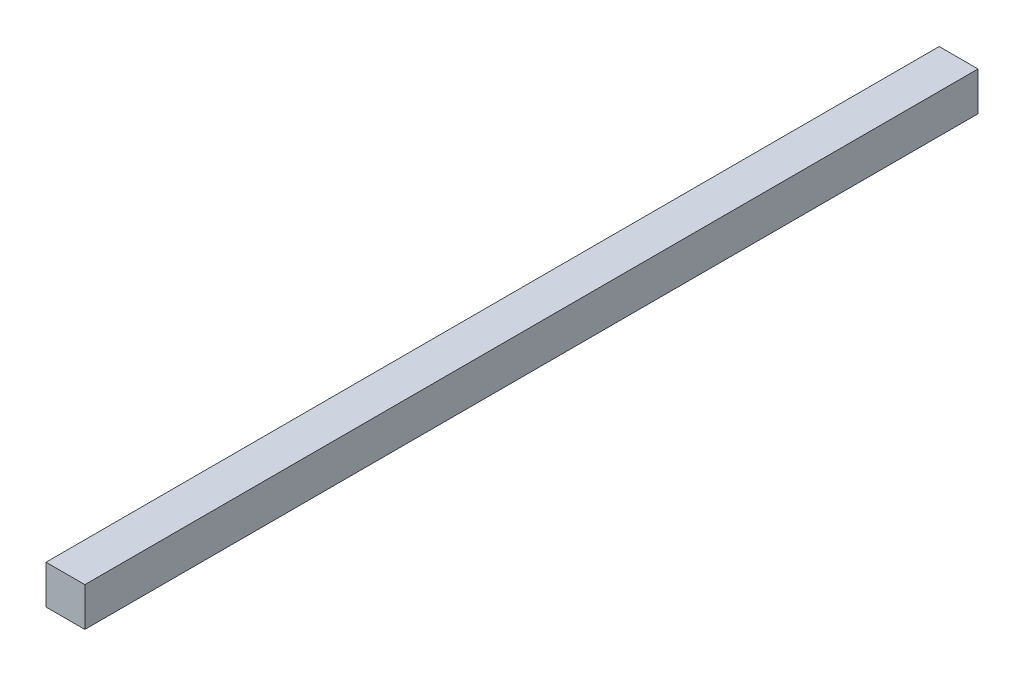
from build123d import *

# Parameters (mm, degrees)
SKETCH1_W           = 2.54
SKETCH1_H           = 2.54
BOSS_EXTRUDE1_DEPTH = 58.42


with BuildPart() as part:
    # Sketch1 → Boss-Extrude1 (new body)
    with BuildSketch(Plane.XY):
        with Locations((-1.27, 1.27)):
            Rectangle(SKETCH1_W, SKETCH1_H)
    extrude(amount=BOSS_EXTRUDE1_DEPTH)


solid = part.part
